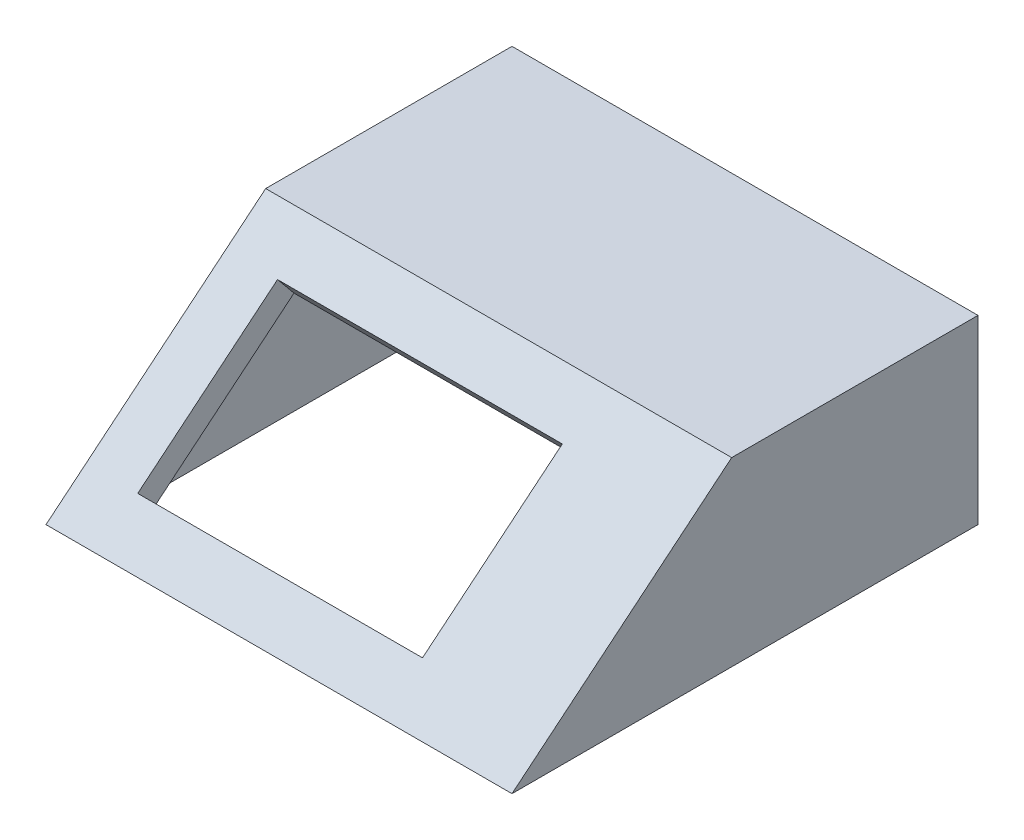
from build123d import *

# Parameters (mm, degrees)
SKETCH2_W               = 47.573593128
SKETCH2_H               = 35
BOSS_EXTRUDE1_DEPTH     = 90
CUT_EXTRUDE1_DEPTH      = 40
CUT_EXTRUDE1_DEPTH_BACK = 40
SKETCH4_W               = 55
SKETCH4_H               = 35
CUT_EXTRUDE2_DEPTH      = 5


with BuildPart() as part:
    # Sketch2 → Boss-Extrude1 (new body)
    with BuildSketch(Plane(origin=(0, 0, 0), x_dir=(0, 0, -1), z_dir=(1, 0, 0))):
        Polygon((-23.786796564, 17.5), (-66.213203436, -17.5), (-23.786796564, -17.5), align=None)
        Rectangle(SKETCH2_W, SKETCH2_H)
        Polygon((-21.990568975, 12.5), (-23.786796564, 11.018187839), (-23.786796564, -17.5), (18.786796564, -17.5), (18.786796564, 12.5), align=None)
        Polygon((-23.786796564, -17.5), (-23.786796564, 11.018187839), (-58.356060578, -17.5), align=None)
    extrude(amount=-BOSS_EXTRUDE1_DEPTH)

    # Sketch3 → Cut-Extrude1 (cut, two sides: drawn at the far end of the back side and taken through both)
    with BuildSketch(Plane.ZY.offset(45).offset(-CUT_EXTRUDE1_DEPTH_BACK)):
        Polygon((-18.786796564, -17.5), (-18.786796564, 12.5), (21.990568975, 12.5), (58.356060578, -17.5), align=None)
    extrude(amount=CUT_EXTRUDE1_DEPTH + CUT_EXTRUDE1_DEPTH_BACK, mode=Mode.SUBTRACT)

    # Sketch4 → Cut-Extrude2 (cut)
    with BuildSketch(Plane(origin=(0, 22.08978209, 18.223140496), x_dir=(1, 0, 0), z_dir=(0, 0.77138921583987, 0.6363636363636365))):
        with Locations((-52.5, -34.712514713)):
            Rectangle(SKETCH4_W, SKETCH4_H)
    extrude(amount=-CUT_EXTRUDE2_DEPTH, mode=Mode.SUBTRACT)


solid = part.part
